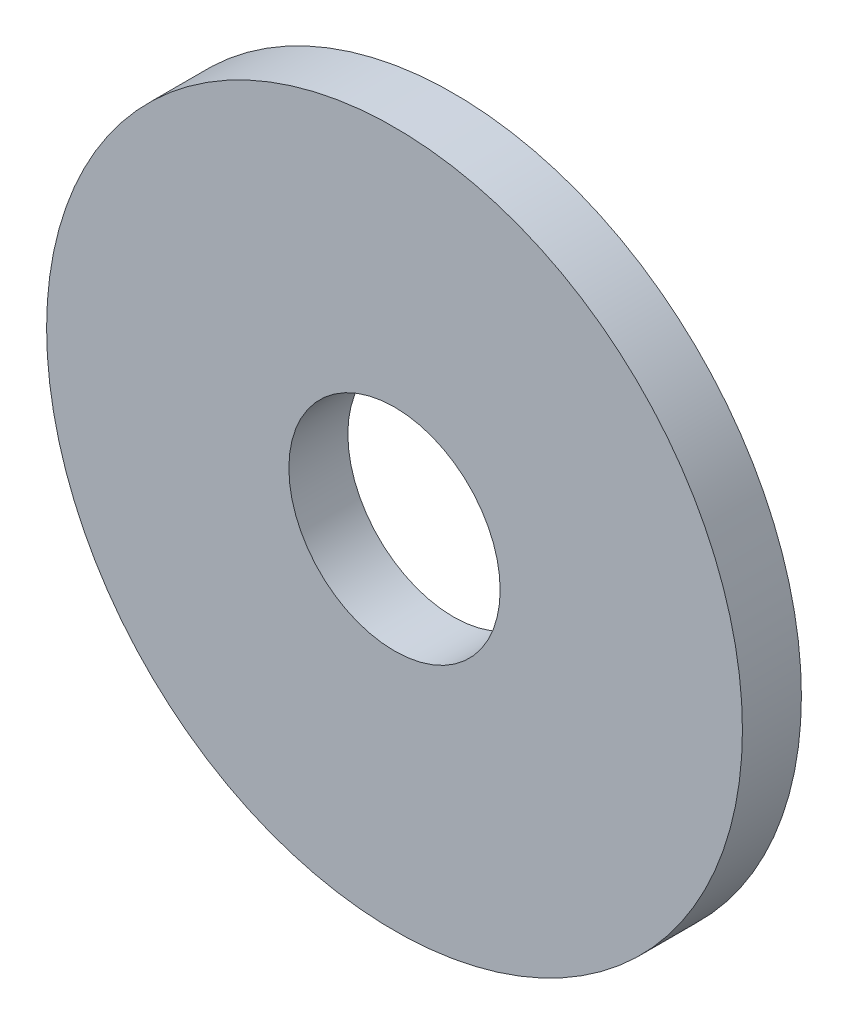
from build123d import *

# Parameters (mm, degrees)
SKETCH1_R           = 7.08
SKETCH1_R_2         = 2.15
BOSS_EXTRUDE1_DEPTH = 0.6


with BuildPart() as part:
    # Sketch1 → Boss-Extrude1 (new, symmetric)
    with BuildSketch(Plane.XY):
        Circle(SKETCH1_R)
        Circle(SKETCH1_R_2, mode=Mode.SUBTRACT)
    extrude(amount=BOSS_EXTRUDE1_DEPTH, both=True)


solid = part.part
